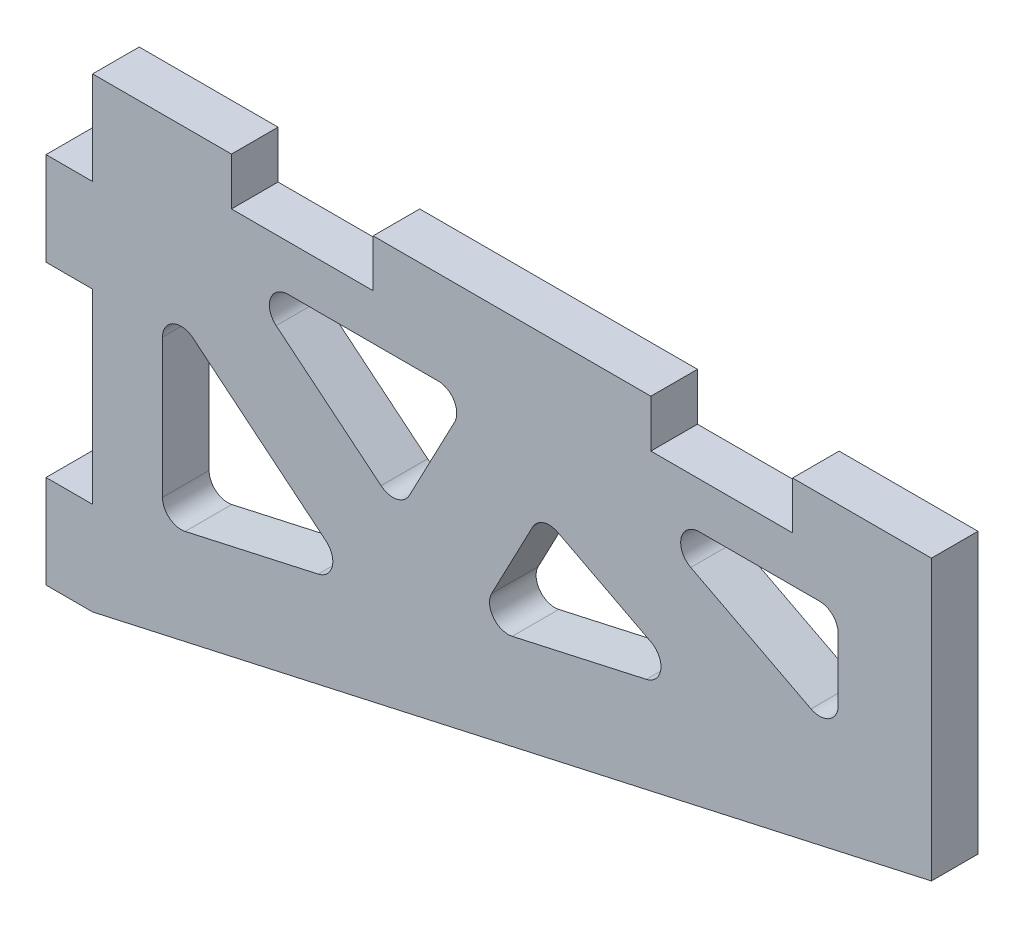
from build123d import *

# Parameters (mm, degrees)
BOSS_EXTRUDE1_DEPTH = 6.35
CUT_EXTRUDE1_DEPTH  = 6.35
FILLET1_R           = 2.54


with BuildPart() as part:
    # Sketch2 → Boss-Extrude1 (new body)
    with BuildSketch(Plane.XY):
        Polygon((-6.35, -63.5), (0, -63.5), (114.3, -38.1), (114.3, 0), (95.377, 0), (95.377, -6.477), (76.073, -6.477), (76.073, 0), (38.227, 0), (38.227, -6.477), (18.923, -6.477), (18.923, 0), (0, 0), (0, -12.7), (-6.35, -12.7), (-6.35, -25.4), (0, -25.4), (0, -50.8), (-6.35, -50.8), align=None)
    extrude(amount=-BOSS_EXTRUDE1_DEPTH)

    # Sketch3 → Cut-Extrude1 (cut)
    with BuildSketch(Plane.XY):
        Polygon((35.837567759, -42.526294431), (9.525, -20.916959432), (9.525, -48.37353171), align=None)
        Polygon((51.284246094, -12.7), (19.530365822, -12.7), (41.715916793, -30.920000703), align=None)
        Polygon((61.141826863, -21.244462208), (51.832146694, -38.971943556), (82.284813735, -32.204684214), align=None)
        Polygon((101.6, -12.7), (72.25424324, -12.7), (101.6, -27.912420599), align=None)
    extrude(amount=-CUT_EXTRUDE1_DEPTH, mode=Mode.SUBTRACT)

    # Fillet1
    fillet1_edges = [part.edges().sort_by_distance(p)[0] for p in [
        (41.715916793, -30.920000703, -3.175),
        (19.530365822, -12.7, -3.175),
        (51.284246094, -12.7, -3.175),
        (61.141826863, -21.244462208, -3.175),
        (82.284813735, -32.204684214, -3.175),
        (51.832146694, -38.971943556, -3.175),
        (72.25424324, -12.7, -3.175),
        (101.6, -12.7, -3.175),
        (101.6, -27.912420599, -3.175),
        (9.525, -20.916959432, -3.175),
        (35.837567759, -42.526294431, -3.175),
        (9.525, -48.37353171, -3.175),
    ]]
    fillet(fillet1_edges, radius=FILLET1_R)


solid = part.part
